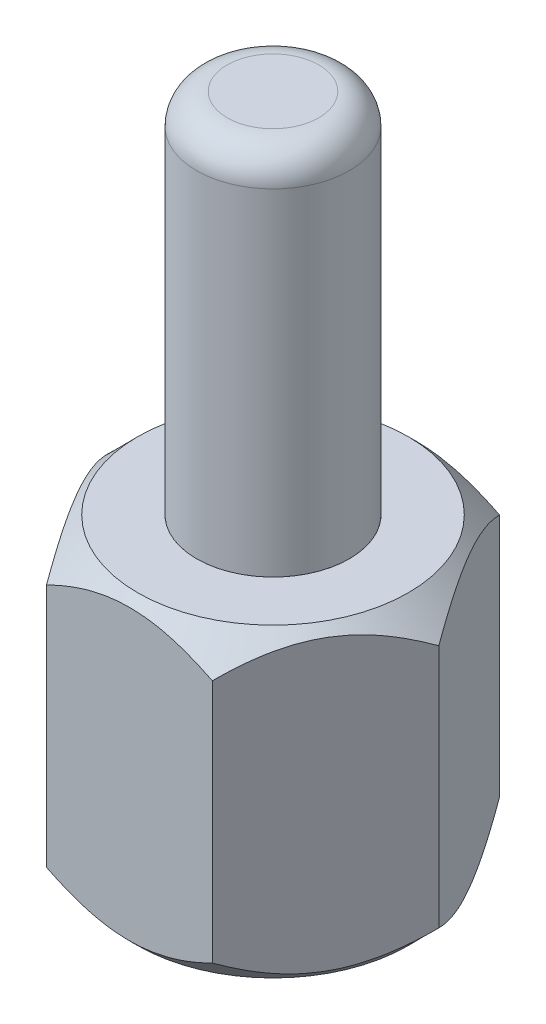
from build123d import *

# Parameters (mm, degrees)
EXTRUDE_1_DEPTH     = 5
SKETCH_2_R          = 1.25
CUT_EXTRUDE_1_DEPTH = 10
SKETCH_4_R          = 1.25
EXTRUDE_2_DEPTH     = 6
FILLET_1_R          = 0.5


with BuildPart() as part:
    # 草图1 → 凸台-拉伸1 (new body)
    with BuildSketch(Plane(origin=(0, 0, 0), x_dir=(1, 0, 0), z_dir=(0, 1, 0))):
        Polygon((2.713546265, 0), (1.356773133, 2.35), (-1.356773133, 2.35), (-2.713546265, 0), (-1.356773133, -2.35), (1.356773133, -2.35), align=None)
    extrude(amount=EXTRUDE_1_DEPTH)

    # 草图2 → 切除-拉伸1 (cut)
    with BuildSketch(Plane.XZ):
        with Locations(Location((0, 0, 0), (0, 0, 270))):
            Circle(SKETCH_2_R)
    extrude(amount=-CUT_EXTRUDE_1_DEPTH, mode=Mode.SUBTRACT)

    # 草图7 → 切除-旋转4 (revolve, cut)
    with BuildSketch(Plane.XY, mode=Mode.PRIVATE) as cut_revolve_4_sk:
        Polygon((-2.713546265, 5), (-2.713546265, 4.5), (-2.213546265, 5), align=None)
    cut_revolve_4 = revolve(cut_revolve_4_sk.sketch.rotate(Axis((0, 0, 0), (0, 1, 0)), 270), axis=Axis((0, 0, 0), (0, 1, 0)), mode=Mode.SUBTRACT)

    # 镜向1: 切除-旋转4 across plane
    add(cut_revolve_4.mirror(Plane(origin=(0, 2.5, 0), x_dir=(0, 0, 1), z_dir=(0, -1, 0))), mode=Mode.SUBTRACT)


with BuildPart() as body_2:
    # 草图4 → 凸台-拉伸2 (new body)
    with BuildSketch(Plane(origin=(0, 5, 0), x_dir=(1, 0, 0), z_dir=(0, 1, 0))):
        with Locations(Location((0, 0, 0), (0, 0, 270))):
            Circle(SKETCH_4_R)
    extrude(amount=EXTRUDE_2_DEPTH)

    # 圆角1
    fillet_1_edges = [body_2.edges().sort_by_distance(p)[0] for p in [
        (0, 11, -1.25),
    ]]
    fillet(fillet_1_edges, radius=FILLET_1_R)


solid = Compound([part.part, body_2.part])
